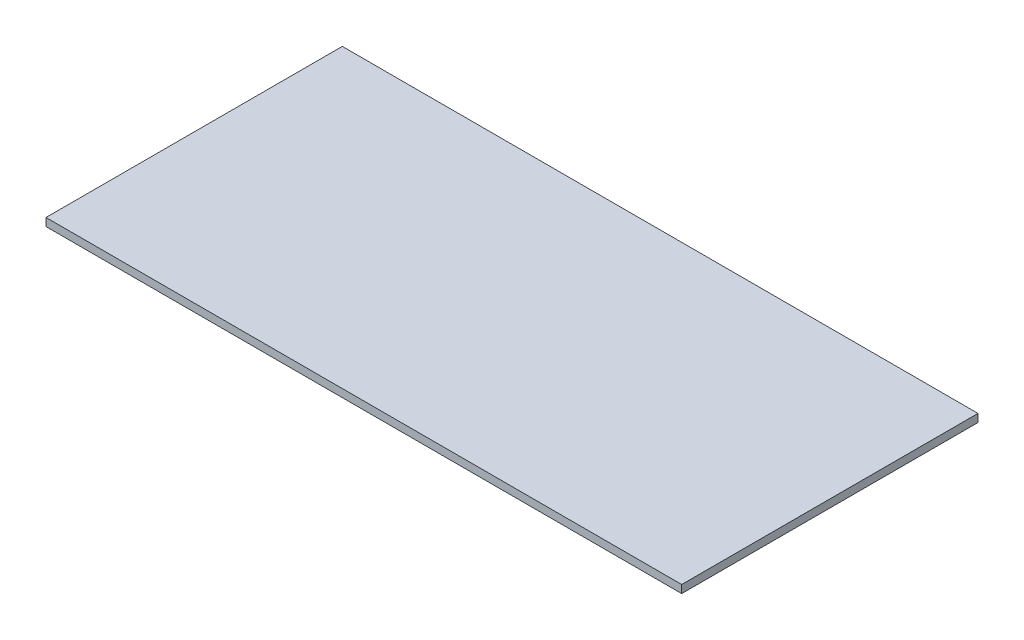
from build123d import *

# Parameters (mm, degrees)
SKETCH1_W           = 32.18
SKETCH1_H           = 15
BOSS_EXTRUDE1_DEPTH = 0.4


with BuildPart() as part:
    # Sketch1 → Boss-Extrude1 (new body)
    with BuildSketch(Plane(origin=(0, 0, 0), x_dir=(1, 0, 0), z_dir=(0, 1, 0))):
        Rectangle(SKETCH1_W, SKETCH1_H)
    extrude(amount=BOSS_EXTRUDE1_DEPTH)


solid = part.part
